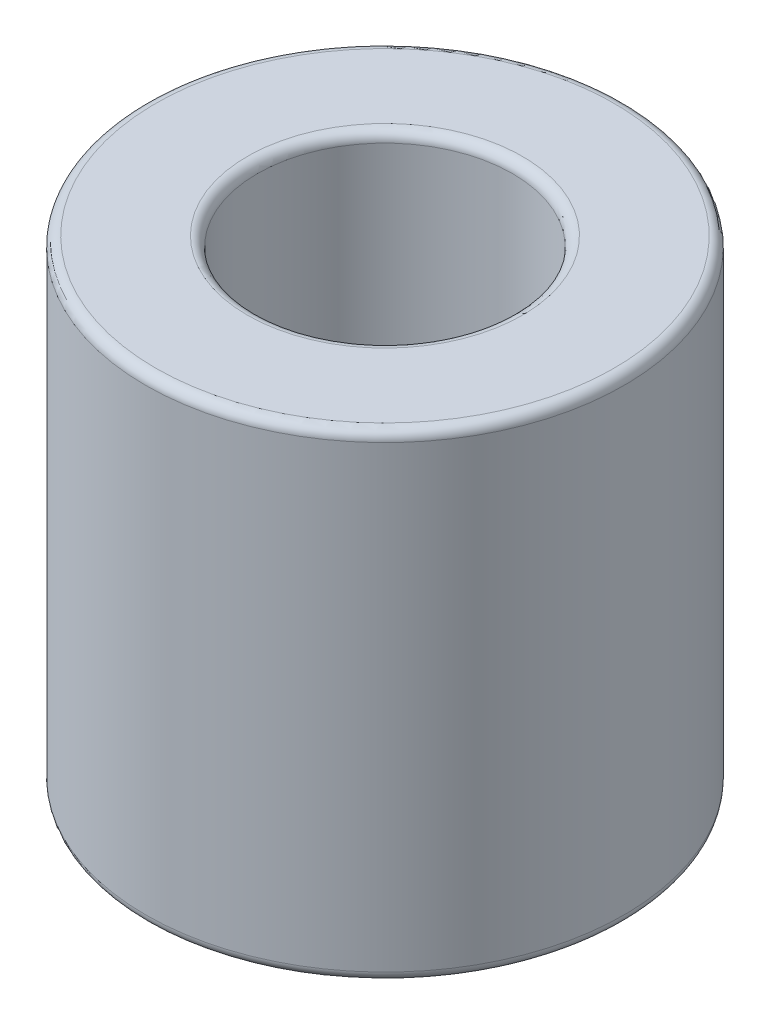
from build123d import *

# Parameters (mm, degrees)
SKETCH1_R           = 3
SKETCH1_R_2         = 1.6
BOSS_EXTRUDE1_DEPTH = 6
FILLET1_R           = 0.125


with BuildPart() as part:
    # Sketch1 → Boss-Extrude1 (new body)
    with BuildSketch(Plane(origin=(0, 0, 0), x_dir=(1, 0, 0), z_dir=(0, 1, 0))):
        with Locations(Location((0, 0, 0), (0, 0, 270))):
            Circle(SKETCH1_R)
        with Locations(Location((0, 0, 0), (0, 0, 270))):
            Circle(SKETCH1_R_2, mode=Mode.SUBTRACT)
    extrude(amount=BOSS_EXTRUDE1_DEPTH)

    # Fillet1
    fillet1_edges = [part.edges().sort_by_distance(p)[0] for p in [
        (0, 0, -3),
        (0, 6, -3),
        (0, 0, -1.6),
        (0, 6, -1.6),
    ]]
    fillet(fillet1_edges, radius=FILLET1_R)


solid = part.part
